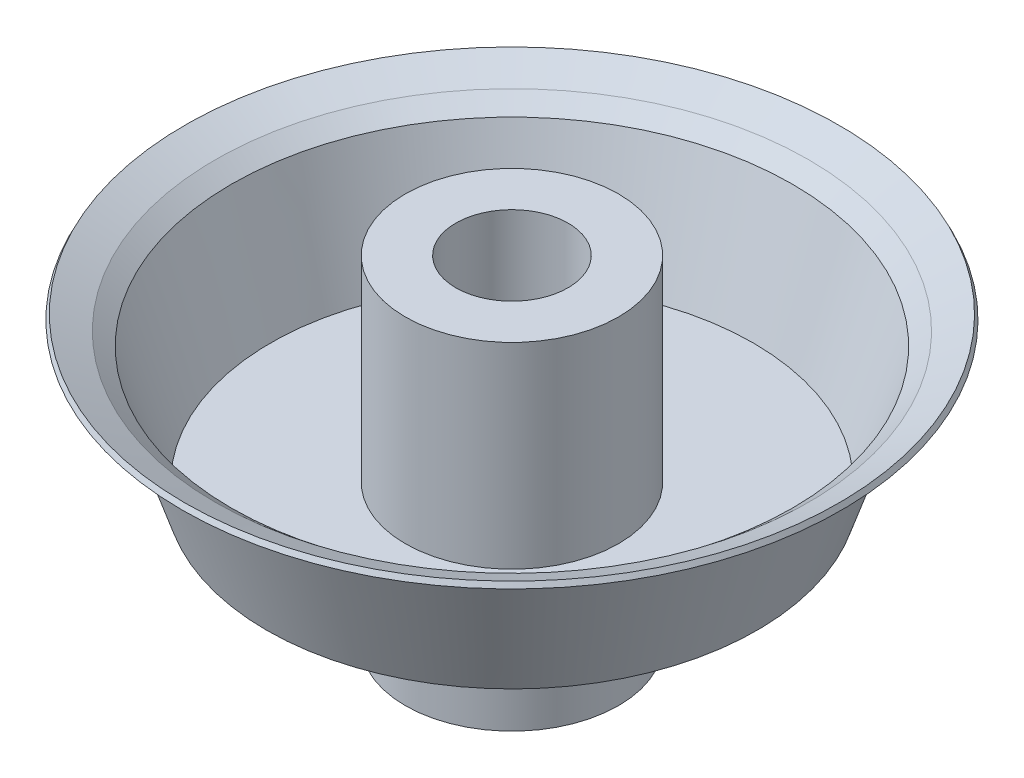
from build123d import *

# Parameters (mm, degrees)
EXTRUDE_10_DEPTH      = 35
EXTRUDE_10_DEPTH_BACK = 25
SKETCH_3_R            = 19
SKETCH_3_R_2          = 10


with BuildPart() as part:
    # Эскиз1 → Повернуть-Тонкостенный1 (revolve)
    with BuildSketch(Plane.XY, mode=Mode.PRIVATE) as revolve_1_sk:
        Polygon((19, 0), (43, 0), (50, 21), (52.889577147, 23.332201276), (58.302767501, 25.953006302), (58.738533119, 25.052946123), (53.42847461, 22.482072549), (50.856038751, 20.405838593), (43.72075922, -1), (19, -1), align=None)
    revolve(revolve_1_sk.sketch.rotate(Axis((0, 0, 0), (0, -1, 0)), 90), axis=Axis((0, 0, 0), (0, -1, 0)))

    # Эскиз3 → Вытянуть10 (add, two sides: drawn at the far end of the back side and taken through both)
    with BuildSketch(Plane(origin=(0, 0, 0), x_dir=(1, 0, 0), z_dir=(0, 1, 0)).offset(-EXTRUDE_10_DEPTH_BACK)):
        with Locations(Location((0, 0, 0), (0, 0, 270))):
            Circle(SKETCH_3_R)
        with Locations(Location((0, 0, 0), (0, 0, 270))):
            Circle(SKETCH_3_R_2, mode=Mode.SUBTRACT)
    extrude(amount=EXTRUDE_10_DEPTH + EXTRUDE_10_DEPTH_BACK)


solid = part.part
